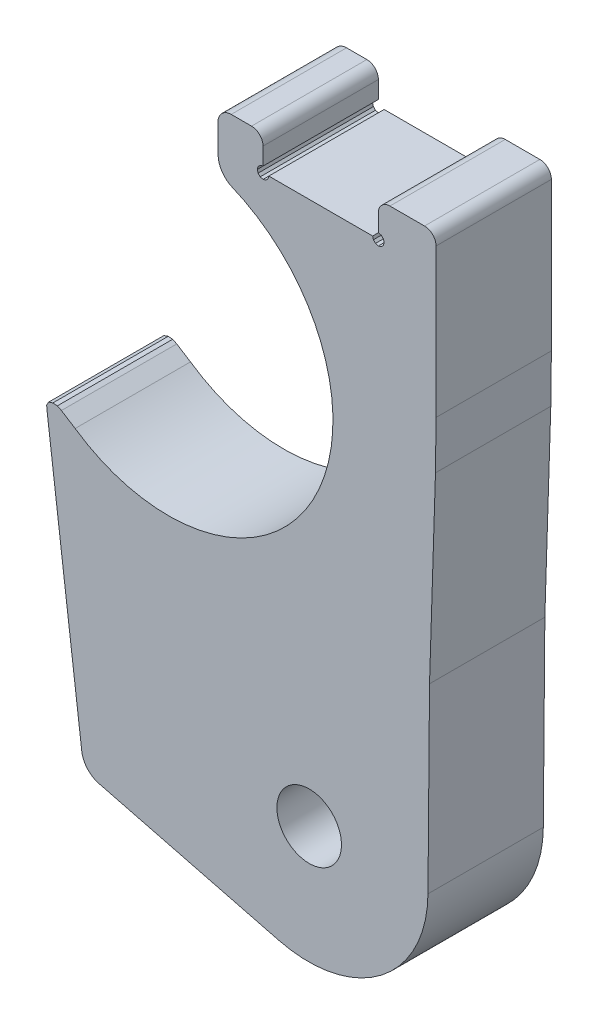
from build123d import *

# Parameters (mm, degrees)
ESQUISSE1_R        = 1.4
BOSS_EXTRU_1_DEPTH = 5


with BuildPart() as part:
    # Esquisse1 → Boss.-Extru.1 (new body)
    with BuildSketch(Plane(origin=(0, 0, 0), x_dir=(-1, 0, 0), z_dir=(0, 0, -1))):
        with BuildLine():
            Line((-15.185840881, 0.170296169), (-7.386227588, 2.157766419))
            ThreePointArc((-7.386227588, 2.157766419), (-6.883257057, 2.465245864), (-6.640893239, 3.002630961))
            Line((-6.640893239, 3.002630961), (-5.14541723, 14.953309043))
            Line((-5.14541723, 14.953309043), (-5.116713392, 15.234944478))
            Line((-5.116713392, 15.234944478), (-5.20171731, 15.387969012))
            Line((-5.20171731, 15.387969012), (-5.386870175, 15.451048966))
            Line((-5.386870175, 15.451048966), (-5.582053032, 15.438258975))
            Line((-5.582053032, 15.438258975), (-5.757396903, 15.351569039))
            Line((-5.757396903, 15.351569039), (-6.353216099, 14.974428283))
            ThreePointArc((-6.353216099, 14.974428283), (-16.665635969, 17.453925295), (-13.127159197, 27.452579762))
            ThreePointArc((-13.127159197, 27.452579762), (-12.708604135, 27.821584741), (-12.552929618, 28.357419099))
            Line((-12.552929618, 28.357419099), (-12.552929618, 29.66633814))
            ThreePointArc((-12.552929618, 29.66633814), (-12.746735333, 30.012603591), (-13.119010387, 30.149977907))
            Line((-13.119010387, 30.149977907), (-13.999989741, 30.149977907))
            ThreePointArc((-13.999989741, 30.149977907), (-14.353542873, 30.003531405), (-14.499989375, 29.649978273))
            Line((-14.499989375, 29.649978273), (-14.499989375, 28.899978823))
            Line((-14.499989375, 28.899978823), (-14.374989466, 28.866488848))
            Line((-14.374989466, 28.866488848), (-14.283479534, 28.774978915))
            Line((-14.283479534, 28.774978915), (-14.249989558, 28.649979006))
            Line((-14.249989558, 28.649979006), (-14.283479534, 28.524979098))
            Line((-14.283479534, 28.524979098), (-14.374989466, 28.433469165))
            Line((-14.374989466, 28.433469165), (-14.499989375, 28.399979189))
            Line((-14.499989375, 28.399979189), (-14.624989283, 28.433469165))
            Line((-14.624989283, 28.433469165), (-14.716499216, 28.524979098))
            Line((-14.716499216, 28.524979098), (-14.749989192, 28.649979006))
            Line((-14.749989192, 28.649979006), (-19.249985894, 28.649979006))
            Line((-19.249985894, 28.649979006), (-19.28347587, 28.524979098))
            Line((-19.28347587, 28.524979098), (-19.374985803, 28.433469165))
            Line((-19.374985803, 28.433469165), (-19.499985711, 28.399979189))
            Line((-19.499985711, 28.399979189), (-19.624985619, 28.433469165))
            Line((-19.624985619, 28.433469165), (-19.716495552, 28.524979098))
            Line((-19.716495552, 28.524979098), (-19.749985528, 28.649979006))
            Line((-19.749985528, 28.649979006), (-19.716495552, 28.774978915))
            Line((-19.716495552, 28.774978915), (-19.624985619, 28.866488848))
            Line((-19.624985619, 28.866488848), (-19.499985711, 28.899978823))
            Line((-19.499985711, 28.899978823), (-19.499985711, 29.649978273))
            ThreePointArc((-19.499985711, 29.649978273), (-19.646432213, 30.003531405), (-19.999985345, 30.149977907))
            Line((-19.999985345, 30.149977907), (-21.499984246, 30.149977907))
            ThreePointArc((-21.499984246, 30.149977907), (-21.853537377, 30.003531405), (-21.999983879, 29.649978273))
            Line((-21.999983879, 29.649978273), (-21.999983879, 23.212152991))
            Line((-21.999983879, 23.212152991), (-21.974503898, 21.118714525))
            Line((-21.974503898, 21.118714525), (-21.716894087, 13.069840423))
            Line((-21.716894087, 13.069840423), (-21.649985688, 5.150180005))
            ThreePointArc((-21.649985688, 5.150180005), (-19.62980681, 1.087138091), (-15.185840881, 0.170296169))
        make_face()
        with Locations((-16.500427031, 5.114893226)):
            Circle(ESQUISSE1_R, mode=Mode.SUBTRACT)
    extrude(amount=-BOSS_EXTRU_1_DEPTH)


solid = part.part
